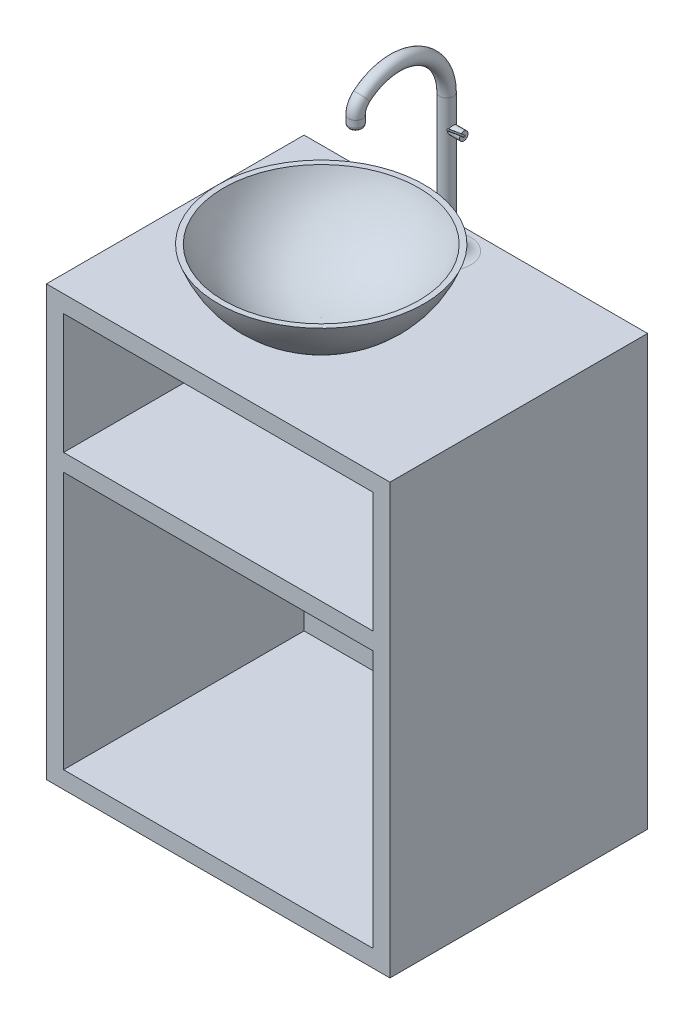
from build123d import *

# Parameters (mm, degrees)
SKETCH_1_W          = 20
SKETCH_1_H          = 25
EXTRUDE_1_DEPTH     = 15
SKETCH_2_W          = 18
SKETCH_2_H          = 7
SKETCH_2_H_2        = 15
CUT_EXTRUDE_1_DEPTH = 14
SKETCH_5_R          = 0.4
FILLET_1_R          = 1
SKETCH_7_R          = 0.25
EXTRUDE_3_DEPTH     = 1
FILLET_2_R          = 0.2


with BuildPart() as part:
    # 草圖1 → 填料-伸長1 (new body)
    with BuildSketch(Plane.XY):
        Rectangle(SKETCH_1_W, SKETCH_1_H)
    extrude(amount=EXTRUDE_1_DEPTH)

    # 草圖2 → 除料-伸長1 (cut)
    with BuildSketch(Plane.XY.offset(15)):
        with Locations((0, 8)):
            Rectangle(SKETCH_2_W, SKETCH_2_H)
        with Locations((0, -4)):
            Rectangle(SKETCH_2_W, SKETCH_2_H_2)
    extrude(amount=-CUT_EXTRUDE_1_DEPTH, mode=Mode.SUBTRACT)

    # 草圖4 → 旋轉4 (revolve)
    with BuildSketch(Plane(origin=(0, 0, 0), x_dir=(0, 0, -1), z_dir=(1, 0, 0)), mode=Mode.PRIVATE) as revolve_4_sk:
        with BuildLine():
            Line((-15, 16.5), (-14.680951103, 16.5))
            ThreePointArc((-14.680951103, 16.5), (-12.457373104, 13.7185354), (-9.016987566, 12.799518652))
            Line((-9.016987566, 12.799518652), (-9, 12.799518652))
            Line((-9, 12.799518652), (-9, 12.5))
            ThreePointArc((-9, 12.5), (-12.66795249, 13.498071265), (-15, 16.5))
        make_face()
    revolve(revolve_4_sk.sketch.rotate(Axis((0, -12.5, 9), (0, 1, 0)), 90), axis=Axis((0, -12.5, 9), (0, 1, 0)))

    # 掃出1: sweep along a path in 草圖6
    with BuildLine(Plane(origin=(0, 0, 0), x_dir=(0, 0, -1), z_dir=(1, 0, 0))) as sweep_1_path:
        Line((-1.7, 12.5), (-1.7, 20.5))
        ThreePointArc((-1.7, 20.5), (-3.443337751, 23.224114533), (-6.647199994, 22.782194598))
        ThreePointArc((-6.647199994, 22.782194598), (-6.906171507, 22.440350482), (-6.998133329, 22.021463065))
        Line((-6.998133329, 22.021463065), (-6.998133329, 21.428362829))
    # 草圖5 → 掃出1 (sweep)
    with BuildSketch(Plane(origin=(0, 12.5, 0), x_dir=(1, 0, 0), z_dir=(0, 1, 0))):
        with Locations((0, -1.7)):
            Circle(SKETCH_5_R)
    sweep(path=sweep_1_path.line)

    # 圓角1
    fillet_1_edges = [part.edges().sort_by_distance(p)[0] for p in [
        (-0.4, 12.5, 1.7),
    ]]
    fillet(fillet_1_edges, radius=FILLET_1_R)

    # 草圖7 → 填料-伸長3 (add)
    with BuildSketch(Plane(origin=(0, 0, 0), x_dir=(0, 0, -1), z_dir=(1, 0, 0))):
        with Locations(Location((-1.7, 18.8, 0), (0, 0, 270))):
            Circle(SKETCH_7_R)
    extrude(amount=EXTRUDE_3_DEPTH)

    # 草圖8 → 旋轉5 (revolve)
    with BuildSketch(Plane(origin=(1, 0, 0), x_dir=(0, 0, -1), z_dir=(1, 0, 0))):
        Polygon((-2.619253332, 19.571345132), (-1.7, 18.8), (-1.73213938, 18.761697778), (-2.651392712, 19.533042909), align=None)
    revolve(axis=Axis((1, 18.8, 1.7), (0, -0.6427876096865434, -0.7660444431189747)))

    # 圓角2
    fillet_2_edges = [part.edges().sort_by_distance(p)[0] for p in [
        (-0.4, 21.428362829, 6.998133329),
    ]]
    fillet(fillet_2_edges, radius=FILLET_2_R)


solid = part.part
